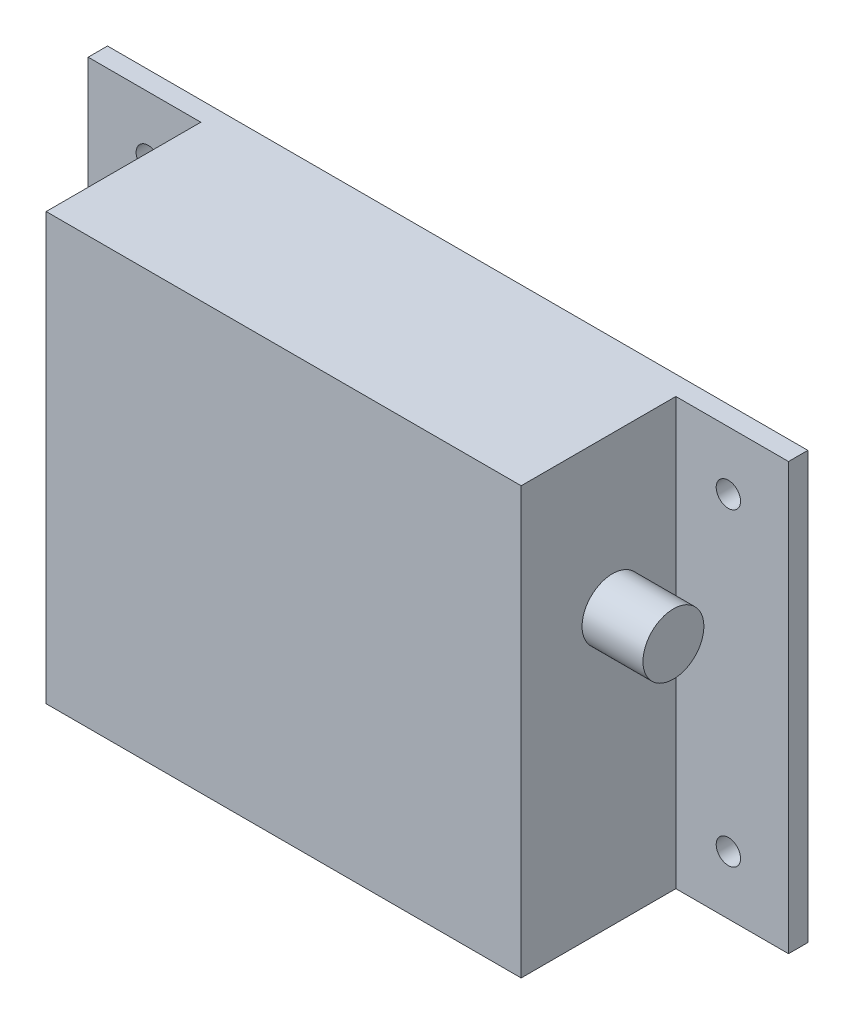
from build123d import *

# Parameters (mm, degrees)
SKETCH1_W           = 78
SKETCH1_H           = 70
BOSS_EXTRUDE1_DEPTH = 28.575
SKETCH2_W           = 115
SKETCH2_H           = 70
BOSS_EXTRUDE2_DEPTH = 3.175
SKETCH3_R           = 2
CUT_EXTRUDE1_DEPTH  = 74.128521283
SKETCH4_R           = 5
BOSS_EXTRUDE3_DEPTH = 10


with BuildPart() as part:
    # Sketch1 → Boss-Extrude1 (new body)
    with BuildSketch(Plane.XY):
        Rectangle(SKETCH1_W, SKETCH1_H)
    extrude(amount=BOSS_EXTRUDE1_DEPTH)

    # Sketch2 → Boss-Extrude2 (add)
    with BuildSketch(Plane(origin=(0, 0, 0), x_dir=(-1, 0, 0), z_dir=(0, 0, -1))):
        Rectangle(SKETCH2_W, SKETCH2_H)
    extrude(amount=-BOSS_EXTRUDE2_DEPTH)

    # Sketch3 → Cut-Extrude1 (cut, through all)
    with BuildSketch(Plane(origin=(0, 0, 0), x_dir=(-1, 0, 0), z_dir=(0, 0, -1))):
        with Locations((-47.625, 25.4)):
            Circle(SKETCH3_R)
        with Locations((47.625, 25.4)):
            Circle(SKETCH3_R)
        with Locations((47.625, -25.4)):
            Circle(SKETCH3_R)
        with Locations((-47.625, -25.4)):
            Circle(SKETCH3_R)
    extrude(amount=-CUT_EXTRUDE1_DEPTH, mode=Mode.SUBTRACT)

    # Sketch4 → Boss-Extrude3 (add)
    with BuildSketch(Plane.ZY.offset(-39)):
        with Locations(Location((13.575, 10, 0), (0, 0, 270))):
            Circle(SKETCH4_R)
    extrude(amount=-BOSS_EXTRUDE3_DEPTH)


solid = part.part
